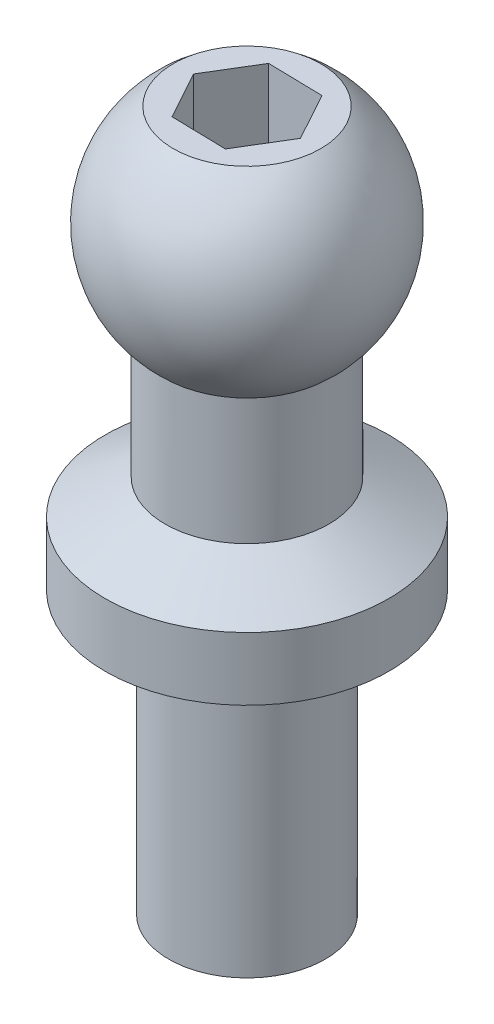
from build123d import *

# Parameters (mm, degrees)
TAGLIO_ESTRUSIONE1_DEPTH = 1.5


with BuildPart() as part:
    # Schizzo1 → Rivoluzione1 (revolve)
    with BuildSketch(Plane.XY, mode=Mode.PRIVATE) as rivoluzione1_sk:
        with BuildLine():
            Line((0, 0), (1.24, 0))
            Line((1.24, 0), (1.24, 4.46))
            Line((1.24, 4.46), (2.25, 4.46))
            Line((2.25, 4.46), (2.25, 5.46))
            Line((2.25, 5.46), (1.3, 6.008482756))
            Line((1.3, 6.008482756), (1.3, 8.008482756))
            ThreePointArc((1.3, 8.008482756), (1.854378023, 10.195968379), (0, 11.481935132))
            Line((0, 11.481935132), (0, 0))
        make_face()
    revolve(rivoluzione1_sk.sketch.rotate(Axis((0, 0, 0), (0, 1, 0)), 90), axis=Axis((0, 0, 0), (0, 1, 0)))

    # TaglioSuperficie1
    split(bisect_by=Plane(origin=(0, 11.1, 0), x_dir=(-1, 0, 0), z_dir=(0, -1, 0)), keep=Keep.TOP)

    # Schizzo2 → Taglio-Estrusione1 (cut)
    with BuildSketch(Plane(origin=(0, 11.1, 0), x_dir=(-1, 0, 0), z_dir=(0, -1, 0))):
        Polygon((-0.416334141, -0.759385201), (0.449479805, -0.740248543), (0.865813946, 0.019136658), (0.416334141, 0.759385201), (-0.449479805, 0.740248543), (-0.865813946, -0.019136658), align=None)
    extrude(amount=TAGLIO_ESTRUSIONE1_DEPTH, mode=Mode.SUBTRACT)


solid = part.part
